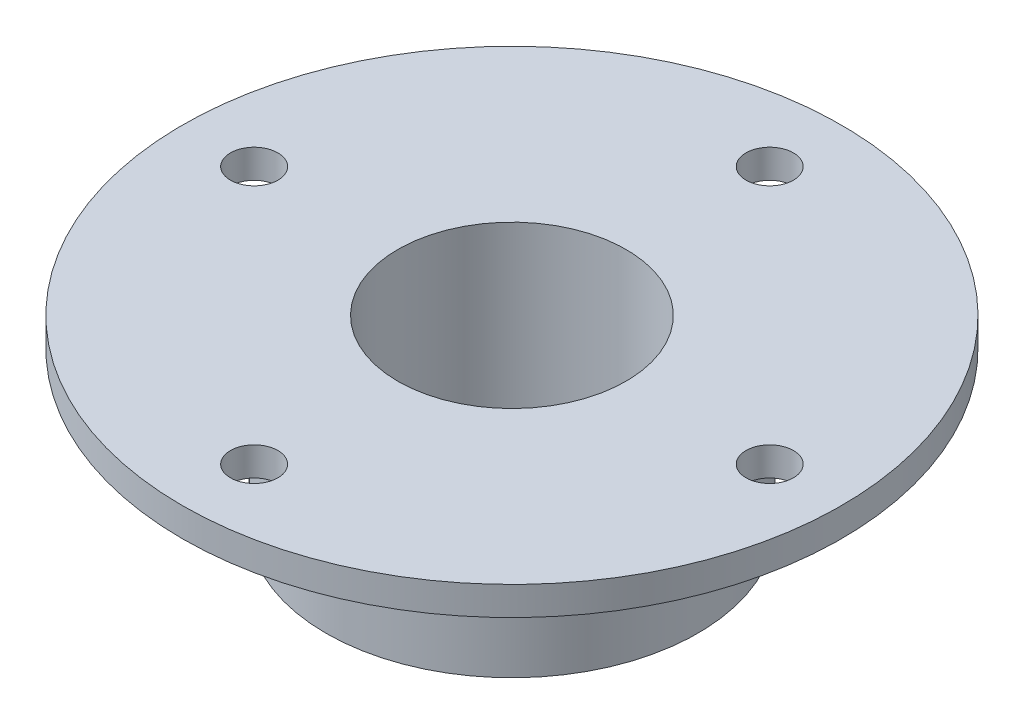
from build123d import *

# Parameters (mm, degrees)
SKETCH6_R          = 1.65
CUT_EXTRUDE1_DEPTH = 2


with BuildPart() as part:
    # Sketch1 → Revolve1 (revolve)
    with BuildSketch(Plane.XY, mode=Mode.PRIVATE) as revolve1_sk:
        Polygon((-7.95, 12.397619048), (-22.95, 12.397619048), (-22.95, 10.397619048), (-12.95, 10.397619048), (-12.95, -0.302380952), (-7.95, -0.302380952), align=None)
    revolve(revolve1_sk.sketch.rotate(Axis((0, 15.542380952, 0), (0, -1, 0)), 270), axis=Axis((0, 15.542380952, 0), (0, -1, 0)))

    # Sketch5 → M3.5 Clearance Hole1 (revolve, cut)
    with BuildSketch(Plane.ZX.offset(5.047619048)):
        Polygon((0, 0), (0, 15.141678207), (1.95, 13.97), (1.95, 0), align=None)
    revolve(axis=Axis((-6.35, 5.047619048, 0), (1, 0, 0)), mode=Mode.SUBTRACT)

    # Sketch6 → Cut-Extrude1 (cut)
    with BuildSketch(Plane.XZ.offset(-10.397619048)):
        with BuildLine():
            ThreePointArc((1.65, 17.95), (1.166726189, 19.116726189), (0, 19.6))
            Line((0, 19.6), (0, 16.3))
            ThreePointArc((0, 16.3), (1.166726189, 16.783273811), (1.65, 17.95))
        make_face()
        with BuildLine():
            Line((0, 16.3), (0, 19.6))
            ThreePointArc((0, 19.6), (-1.65, 17.95), (0, 16.3))
        make_face()
        with Locations(Location((17.95, 0, 0), (0, 0, 270))):
            Circle(SKETCH6_R)
        with BuildLine():
            ThreePointArc((1.65, -17.95), (1.166726189, -16.783273811), (0, -16.3))
            Line((0, -16.3), (0, -19.6))
            ThreePointArc((0, -19.6), (1.166726189, -19.116726189), (1.65, -17.95))
        make_face()
        with BuildLine():
            Line((0, -19.6), (0, -16.3))
            ThreePointArc((0, -16.3), (-1.65, -17.95), (0, -19.6))
        make_face()
        with Locations(Location((-17.95, 0, 0), (0, 0, 270))):
            Circle(SKETCH6_R)
    extrude(amount=-CUT_EXTRUDE1_DEPTH, mode=Mode.SUBTRACT)


solid = part.part
